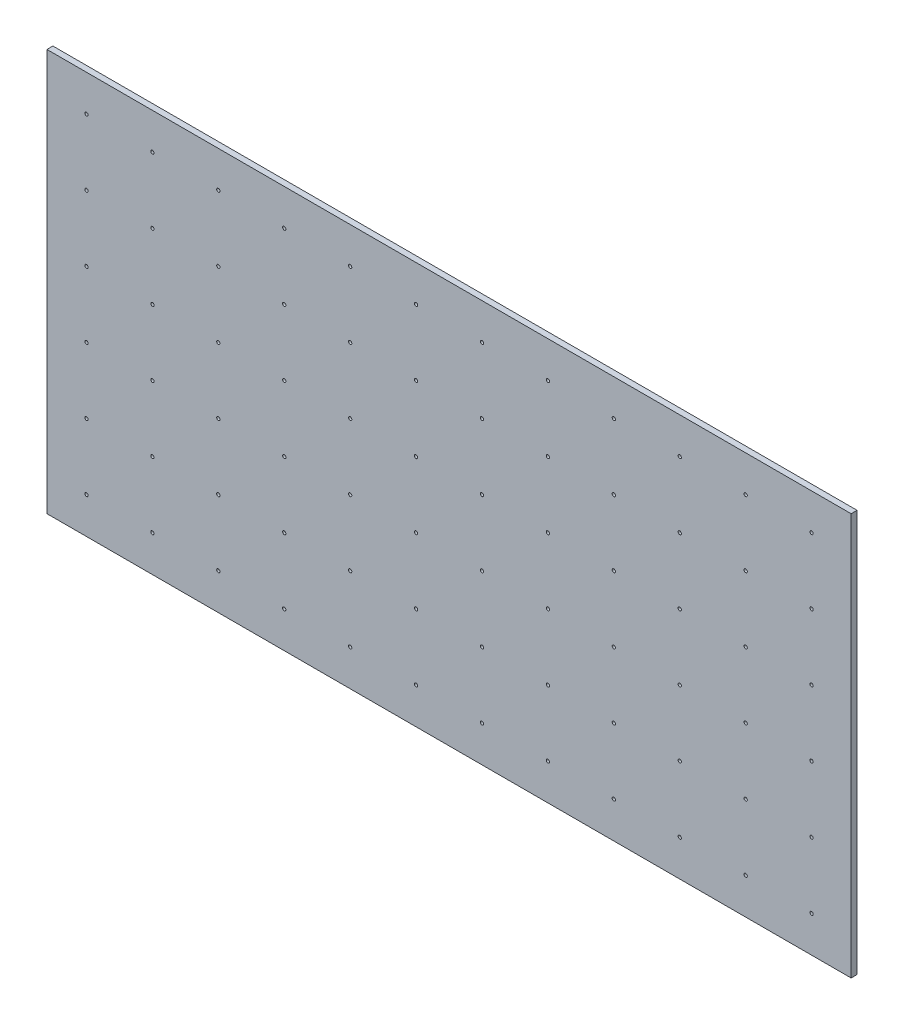
from build123d import *

# Parameters (mm, degrees)
SKETCH1_W           = 2440
SKETCH1_H           = 1220
SKETCH1_R           = 5
BOSS_EXTRUDE1_DEPTH = 18


with BuildPart() as part:
    # Sketch1 → Boss-Extrude1 (new body)
    with BuildSketch(Plane.XY):
        with Locations((-71.206225681, 68.832684825)):
            Rectangle(SKETCH1_W, SKETCH1_H)
        with Locations((-1171.206225681, 568.832684825)):
            Circle(SKETCH1_R, mode=Mode.SUBTRACT)
        with Locations((-971.206225681, 568.832684825)):
            Circle(SKETCH1_R, mode=Mode.SUBTRACT)
        with Locations((-771.206225681, 568.832684825)):
            Circle(SKETCH1_R, mode=Mode.SUBTRACT)
        with Locations((-571.206225681, 568.832684825)):
            Circle(SKETCH1_R, mode=Mode.SUBTRACT)
        with Locations((-371.206225681, 568.832684825)):
            Circle(SKETCH1_R, mode=Mode.SUBTRACT)
        with Locations((-171.206225681, 568.832684825)):
            Circle(SKETCH1_R, mode=Mode.SUBTRACT)
        with Locations((28.793774319, 568.832684825)):
            Circle(SKETCH1_R, mode=Mode.SUBTRACT)
        with Locations((228.793774319, 568.832684825)):
            Circle(SKETCH1_R, mode=Mode.SUBTRACT)
        with Locations((428.793774319, 568.832684825)):
            Circle(SKETCH1_R, mode=Mode.SUBTRACT)
        with Locations((628.793774319, 568.832684825)):
            Circle(SKETCH1_R, mode=Mode.SUBTRACT)
        with Locations((828.793774319, 568.832684825)):
            Circle(SKETCH1_R, mode=Mode.SUBTRACT)
        with Locations((1028.793774319, 568.832684825)):
            Circle(SKETCH1_R, mode=Mode.SUBTRACT)
        with Locations((1028.793774319, 368.832684825)):
            Circle(SKETCH1_R, mode=Mode.SUBTRACT)
        with Locations((1028.793774319, 168.832684825)):
            Circle(SKETCH1_R, mode=Mode.SUBTRACT)
        with Locations((1028.793774319, -31.167315175)):
            Circle(SKETCH1_R, mode=Mode.SUBTRACT)
        with Locations((1028.793774319, -231.167315175)):
            Circle(SKETCH1_R, mode=Mode.SUBTRACT)
        with Locations((1028.793774319, -431.167315175)):
            Circle(SKETCH1_R, mode=Mode.SUBTRACT)
        with Locations((828.793774319, -431.167315175)):
            Circle(SKETCH1_R, mode=Mode.SUBTRACT)
        with Locations((628.793774319, -431.167315175)):
            Circle(SKETCH1_R, mode=Mode.SUBTRACT)
        with Locations((428.793774319, -431.167315175)):
            Circle(SKETCH1_R, mode=Mode.SUBTRACT)
        with Locations((228.793774319, -431.167315175)):
            Circle(SKETCH1_R, mode=Mode.SUBTRACT)
        with Locations((28.793774319, -431.167315175)):
            Circle(SKETCH1_R, mode=Mode.SUBTRACT)
        with Locations((-171.206225681, -431.167315175)):
            Circle(SKETCH1_R, mode=Mode.SUBTRACT)
        with Locations((-371.206225681, -431.167315175)):
            Circle(SKETCH1_R, mode=Mode.SUBTRACT)
        with Locations((-571.206225681, -431.167315175)):
            Circle(SKETCH1_R, mode=Mode.SUBTRACT)
        with Locations((-771.206225681, -431.167315175)):
            Circle(SKETCH1_R, mode=Mode.SUBTRACT)
        with Locations((-971.206225681, -431.167315175)):
            Circle(SKETCH1_R, mode=Mode.SUBTRACT)
        with Locations((-1171.206225681, -431.167315175)):
            Circle(SKETCH1_R, mode=Mode.SUBTRACT)
        with Locations((-1171.206225681, -231.167315175)):
            Circle(SKETCH1_R, mode=Mode.SUBTRACT)
        with Locations((-1171.206225681, -31.167315175)):
            Circle(SKETCH1_R, mode=Mode.SUBTRACT)
        with Locations((-1171.206225681, 168.832684825)):
            Circle(SKETCH1_R, mode=Mode.SUBTRACT)
        with Locations((-1171.206225681, 368.832684825)):
            Circle(SKETCH1_R, mode=Mode.SUBTRACT)
        with Locations((-971.206225681, 368.832684825)):
            Circle(SKETCH1_R, mode=Mode.SUBTRACT)
        with Locations((-771.206225681, 368.832684825)):
            Circle(SKETCH1_R, mode=Mode.SUBTRACT)
        with Locations((-571.206225681, 368.832684825)):
            Circle(SKETCH1_R, mode=Mode.SUBTRACT)
        with Locations((-371.206225681, 368.832684825)):
            Circle(SKETCH1_R, mode=Mode.SUBTRACT)
        with Locations((-171.206225681, 368.832684825)):
            Circle(SKETCH1_R, mode=Mode.SUBTRACT)
        with Locations((28.793774319, 368.832684825)):
            Circle(SKETCH1_R, mode=Mode.SUBTRACT)
        with Locations((228.793774319, 368.832684825)):
            Circle(SKETCH1_R, mode=Mode.SUBTRACT)
        with Locations((428.793774319, 368.832684825)):
            Circle(SKETCH1_R, mode=Mode.SUBTRACT)
        with Locations((628.793774319, 368.832684825)):
            Circle(SKETCH1_R, mode=Mode.SUBTRACT)
        with Locations((828.793774319, 368.832684825)):
            Circle(SKETCH1_R, mode=Mode.SUBTRACT)
        with Locations((828.793774319, 168.832684825)):
            Circle(SKETCH1_R, mode=Mode.SUBTRACT)
        with Locations((828.793774319, -31.167315175)):
            Circle(SKETCH1_R, mode=Mode.SUBTRACT)
        with Locations((828.793774319, -231.167315175)):
            Circle(SKETCH1_R, mode=Mode.SUBTRACT)
        with Locations((628.793774319, -231.167315175)):
            Circle(SKETCH1_R, mode=Mode.SUBTRACT)
        with Locations((428.793774319, -231.167315175)):
            Circle(SKETCH1_R, mode=Mode.SUBTRACT)
        with Locations((228.793774319, -231.167315175)):
            Circle(SKETCH1_R, mode=Mode.SUBTRACT)
        with Locations((28.793774319, -231.167315175)):
            Circle(SKETCH1_R, mode=Mode.SUBTRACT)
        with Locations((-171.206225681, -231.167315175)):
            Circle(SKETCH1_R, mode=Mode.SUBTRACT)
        with Locations((-371.206225681, -231.167315175)):
            Circle(SKETCH1_R, mode=Mode.SUBTRACT)
        with Locations((-571.206225681, -231.167315175)):
            Circle(SKETCH1_R, mode=Mode.SUBTRACT)
        with Locations((-771.206225681, -231.167315175)):
            Circle(SKETCH1_R, mode=Mode.SUBTRACT)
        with Locations((-971.206225681, -231.167315175)):
            Circle(SKETCH1_R, mode=Mode.SUBTRACT)
        with Locations((-971.206225681, -31.167315175)):
            Circle(SKETCH1_R, mode=Mode.SUBTRACT)
        with Locations((-971.206225681, 168.832684825)):
            Circle(SKETCH1_R, mode=Mode.SUBTRACT)
        with Locations((-771.206225681, 168.832684825)):
            Circle(SKETCH1_R, mode=Mode.SUBTRACT)
        with Locations((-571.206225681, 168.832684825)):
            Circle(SKETCH1_R, mode=Mode.SUBTRACT)
        with Locations((-371.206225681, 168.832684825)):
            Circle(SKETCH1_R, mode=Mode.SUBTRACT)
        with Locations((-171.206225681, 168.832684825)):
            Circle(SKETCH1_R, mode=Mode.SUBTRACT)
        with Locations((28.793774319, 168.832684825)):
            Circle(SKETCH1_R, mode=Mode.SUBTRACT)
        with Locations((228.793774319, 168.832684825)):
            Circle(SKETCH1_R, mode=Mode.SUBTRACT)
        with Locations((428.793774319, 168.832684825)):
            Circle(SKETCH1_R, mode=Mode.SUBTRACT)
        with Locations((628.793774319, 168.832684825)):
            Circle(SKETCH1_R, mode=Mode.SUBTRACT)
        with Locations((628.793774319, -31.167315175)):
            Circle(SKETCH1_R, mode=Mode.SUBTRACT)
        with Locations((428.793774319, -31.167315175)):
            Circle(SKETCH1_R, mode=Mode.SUBTRACT)
        with Locations((228.793774319, -31.167315175)):
            Circle(SKETCH1_R, mode=Mode.SUBTRACT)
        with Locations((28.793774319, -31.167315175)):
            Circle(SKETCH1_R, mode=Mode.SUBTRACT)
        with Locations((-171.206225681, -31.167315175)):
            Circle(SKETCH1_R, mode=Mode.SUBTRACT)
        with Locations((-371.206225681, -31.167315175)):
            Circle(SKETCH1_R, mode=Mode.SUBTRACT)
        with Locations((-571.206225681, -31.167315175)):
            Circle(SKETCH1_R, mode=Mode.SUBTRACT)
        with Locations((-771.206225681, -31.167315175)):
            Circle(SKETCH1_R, mode=Mode.SUBTRACT)
    extrude(amount=BOSS_EXTRUDE1_DEPTH)


solid = part.part
